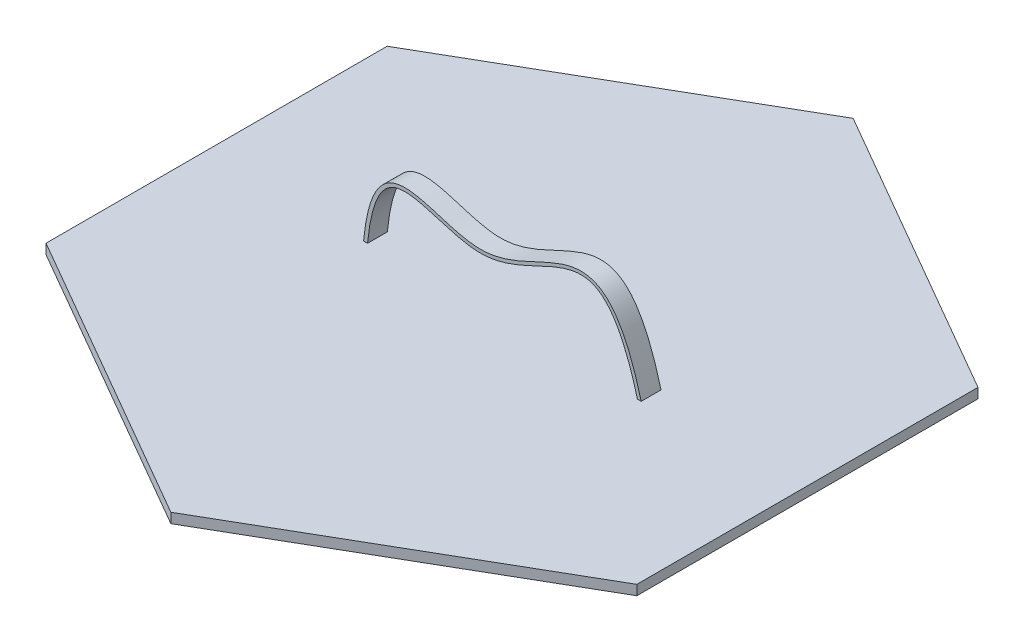
from build123d import *

# Parameters (mm, degrees)
BOSS_EXTRUDE1_DEPTH = 2.5
BOSS_EXTRUDE3_DEPTH = 2.5


with BuildPart() as part:
    # Sketch1 → Boss-Extrude1 (new body)
    with BuildSketch(Plane(origin=(0, 0, 0), x_dir=(1, 0, 0), z_dir=(0, 1, 0))):
        Polygon((74.478184725, 43), (0, 86), (-74.478184725, 43), (-74.478184725, -43), (0, -86), (74.478184725, -43), align=None)
    extrude(amount=BOSS_EXTRUDE1_DEPTH)

    # Sketch3 → Boss-Extrude3 (add, symmetric)
    with BuildSketch(Plane.XY):
        with BuildLine():
            Line((-34.925061785, 2.5), (-33.920058448, 2.5))
            add(Edge.make_bspline(
                [(-33.920058448, 2.5), (-33.917714333, 2.524136942), (-33.913611653, 2.566166439), (-33.866227824, 3.047358518), (-33.766675223, 3.968656997), (-33.543636065, 5.697492998), (-33.208094305, 7.727036524), (-32.732470915, 9.857688537), (-32.007597516, 12.3221702), (-30.947827565, 14.726109244), (-29.496843491, 16.656599478), (-27.918808177, 17.817788786), (-25.584089516, 18.616023277), (-22.027089573, 18.448365095), (-16.980597414, 17.01454632), (-11.504417112, 15.301442536), (-6.727145071, 14.453209419), (-2.889367791, 14.698102091), (0.821978206, 15.488717654), (5.270865061, 17.204085784), (10.310286951, 19.65834123), (15.042453427, 21.768085831), (18.653774649, 22.640567877), (21.300542559, 22.524752908), (23.196966016, 21.975950032), (25.06481994, 20.867848988), (26.936162582, 19.06478675), (28.798725849, 16.441516786), (30.32418762, 13.488682834), (31.519963625, 10.621236271), (32.402488107, 8.209159025), (33.126607206, 5.965942013), (33.665257214, 4.140301082), (33.931776285, 3.187716336), (34.072246391, 2.672840674), (34.101906516, 2.563465), (34.119055988, 2.5)],
                knots=[0, 0, 0, 0, 0.000400295, 0.000667158, 0.0078125, 0.015625, 0.03125, 0.046875, 0.0625, 0.09375, 0.125, 0.15625, 0.1875, 0.25, 0.3125, 0.375, 0.4375, 0.46875, 0.5, 0.5625, 0.625, 0.6875, 0.75, 0.78125, 0.8125, 0.84375, 0.875, 0.90625, 0.9375, 0.953125, 0.96875, 0.984375, 0.9921875, 0.998375544, 0.999025327, 1, 1, 1, 1], degree=3))
            Line((34.119055988, 2.5), (35.074938215, 2.5))
            add(Edge.make_bspline(
                [(-34.925061785, 2.5), (-32.150541188, 30.388634665), (-0.320997251, -3.695090393), (25.079154745, 39.838944932), (35.074938215, 2.5)],
                knots=[0, 0, 0, 0, 0.444258071, 1, 1, 1, 1], degree=3))
        make_face()
    extrude(amount=BOSS_EXTRUDE3_DEPTH, both=True)


solid = part.part
